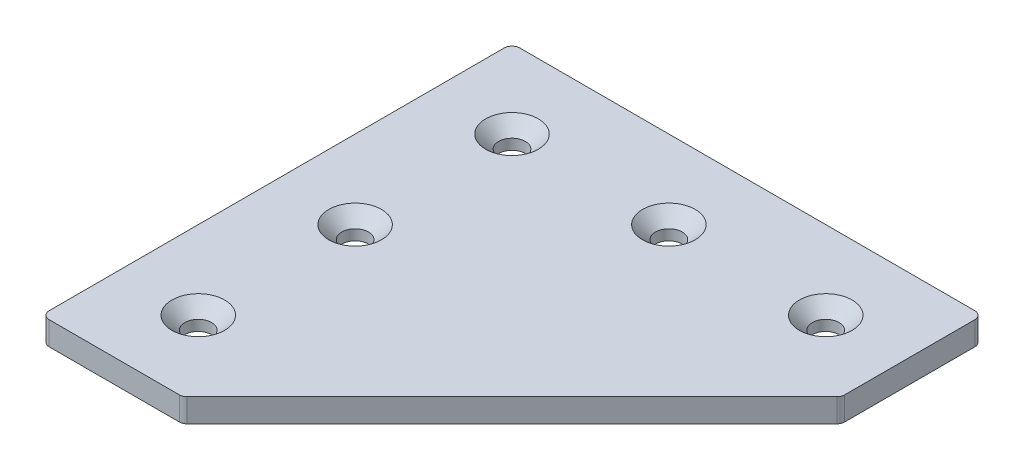
from build123d import *

# Parameters (mm, degrees)
SKETCH2_W                                    = 60
SKETCH2_H                                    = 60
BOSS_EXTRUDE1_DEPTH                          = 3
CUT_EXTRUDE1_DEPTH                           = 10
CSK_FOR_M3_HEX_SOCKET_COUNTERSUNK_CA_2_COUNT = 2
CSK_FOR_M3_HEX_SOCKET_COUNTERSUNK_CA_2_PITCH = 20
CSK_FOR_M3_HEX_SOCKET_COUNTERSUNK_CA_3_COUNT = 2
CSK_FOR_M3_HEX_SOCKET_COUNTERSUNK_CA_3_PITCH = 40
CSK_FOR_M3_HEX_SOCKET_COUNTERSUNK_CA_4_COUNT = 2
CSK_FOR_M3_HEX_SOCKET_COUNTERSUNK_CA_4_PITCH = 20
CSK_FOR_M3_HEX_SOCKET_COUNTERSUNK_CA_5_COUNT = 2
CSK_FOR_M3_HEX_SOCKET_COUNTERSUNK_CA_5_PITCH = 40
FILLET1_R                                    = 1


with BuildPart() as part:
    # Sketch2 → Boss-Extrude1 (new body)
    with BuildSketch(Plane(origin=(0, 0, 0), x_dir=(1, 0, 0), z_dir=(0, 1, 0))):
        Rectangle(SKETCH2_W, SKETCH2_H)
    extrude(amount=BOSS_EXTRUDE1_DEPTH)

    # Sketch3 → Cut-Extrude1 (cut)
    with BuildSketch(Plane(origin=(0, 3, 0), x_dir=(1, 0, 0), z_dir=(0, 1, 0))):
        Polygon((30, 12), (-12, -30), (30, -30), align=None)
    extrude(amount=-CUT_EXTRUDE1_DEPTH, mode=Mode.SUBTRACT)

    # Sketch6 → CSK for M3 Hex Socket Countersunk Cap Screw1 (revolve, cut)
    with BuildSketch(Plane(origin=(-20, 3, -20), x_dir=(0, 0, 1), z_dir=(1, 0, 0))):
        Polygon((0, 0), (0, 3), (1.7, 3), (1.7, 1.66), (3.36, 0), align=None)
    csk_for_m3_hex_socket_countersunk_cap_sc = revolve(axis=Axis((-20, 9.35, -20), (0, -1, 0)), mode=Mode.SUBTRACT)

    # CSK for M3 Hex Socket Countersunk Ca 2: CSK for M3 Hex Socket Countersunk Cap Screw1 ×2
    with Locations(*[(i * CSK_FOR_M3_HEX_SOCKET_COUNTERSUNK_CA_2_PITCH, 0, 0) for i in range(1, CSK_FOR_M3_HEX_SOCKET_COUNTERSUNK_CA_2_COUNT)]):
        add(csk_for_m3_hex_socket_countersunk_cap_sc, mode=Mode.SUBTRACT)

    # CSK for M3 Hex Socket Countersunk Ca 3: CSK for M3 Hex Socket Countersunk Cap Screw1 ×2
    with Locations(*[(i * CSK_FOR_M3_HEX_SOCKET_COUNTERSUNK_CA_3_PITCH, 0, 0) for i in range(1, CSK_FOR_M3_HEX_SOCKET_COUNTERSUNK_CA_3_COUNT)]):
        add(csk_for_m3_hex_socket_countersunk_cap_sc, mode=Mode.SUBTRACT)

    # CSK for M3 Hex Socket Countersunk Ca 4: CSK for M3 Hex Socket Countersunk Cap Screw1 ×2
    with Locations(*[(0, 0, i * CSK_FOR_M3_HEX_SOCKET_COUNTERSUNK_CA_4_PITCH) for i in range(1, CSK_FOR_M3_HEX_SOCKET_COUNTERSUNK_CA_4_COUNT)]):
        add(csk_for_m3_hex_socket_countersunk_cap_sc, mode=Mode.SUBTRACT)

    # CSK for M3 Hex Socket Countersunk Ca 5: CSK for M3 Hex Socket Countersunk Cap Screw1 ×2
    with Locations(*[(0, 0, i * CSK_FOR_M3_HEX_SOCKET_COUNTERSUNK_CA_5_PITCH) for i in range(1, CSK_FOR_M3_HEX_SOCKET_COUNTERSUNK_CA_5_COUNT)]):
        add(csk_for_m3_hex_socket_countersunk_cap_sc, mode=Mode.SUBTRACT)

    # Fillet1
    fillet1_edges = [part.edges().sort_by_distance(p)[0] for p in [
        (30, 1.5, -12),
        (-12, 1.5, 30),
        (-30, 1.5, 30),
        (-30, 1.5, -30),
        (30, 1.5, -30),
    ]]
    fillet(fillet1_edges, radius=FILLET1_R)


solid = part.part
